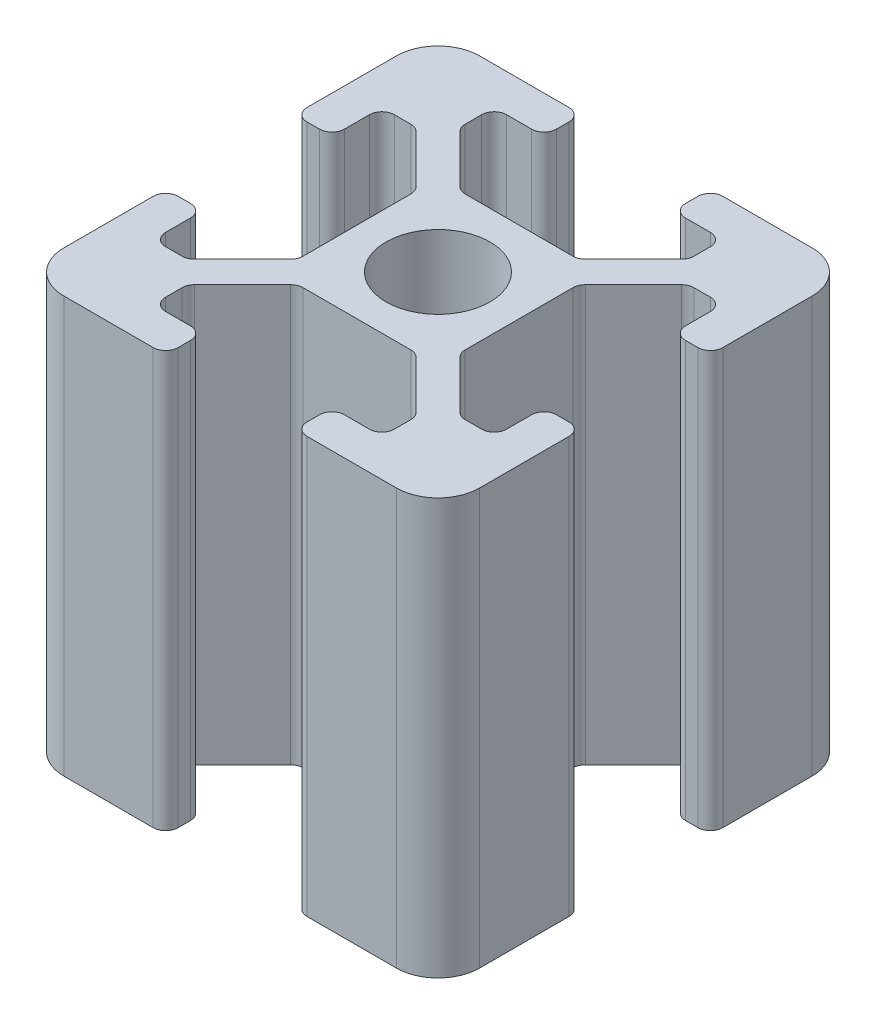
from build123d import *

# Parameters (mm, degrees)
SKETCH_1_R      = 2.5
EXTRUDE_1_DEPTH = 20


with BuildPart() as part:
    # 草图1 → 凸台-拉伸1 (new body)
    with BuildSketch(Plane(origin=(0, 0, 0), x_dir=(1, 0, 0), z_dir=(0, 1, 0))):
        with BuildLine():
            Line((3.1, 8.8), (3.1, 9.4))
            ThreePointArc((3.1, 9.4), (3.275735931, 9.824264069), (3.7, 10))
            Line((3.7, 10), (8, 10))
            ThreePointArc((8, 10), (9.414213562, 9.414213562), (10, 8))
            Line((10, 8), (10, 3.7))
            ThreePointArc((10, 3.7), (9.824264069, 3.275735931), (9.4, 3.1))
            Line((9.4, 3.1), (8.8, 3.1))
            ThreePointArc((8.8, 3.1), (8.375735931, 3.275735931), (8.2, 3.7))
            Line((8.2, 3.7), (8.2, 4.9))
            ThreePointArc((8.2, 4.9), (8.024264069, 5.324264069), (7.6, 5.5))
            Line((7.6, 5.5), (6.809188309, 5.5))
            ThreePointArc((6.809188309, 5.5), (6.57957825, 5.45432772), (6.38492424, 5.324264069))
            Line((6.38492424, 5.324264069), (4.075735931, 3.01507576))
            ThreePointArc((4.075735931, 3.01507576), (3.94567228, 2.82042175), (3.9, 2.590811691))
            Line((3.9, 2.590811691), (3.9, 0))
            Line((3.9, 0), (3.9, -2.590811691))
            ThreePointArc((3.9, -2.590811691), (3.94567228, -2.82042175), (4.075735931, -3.01507576))
            Line((4.075735931, -3.01507576), (6.38492424, -5.324264069))
            ThreePointArc((6.38492424, -5.324264069), (6.57957825, -5.45432772), (6.809188309, -5.5))
            Line((6.809188309, -5.5), (7.6, -5.5))
            ThreePointArc((7.6, -5.5), (8.024264069, -5.324264069), (8.2, -4.9))
            Line((8.2, -4.9), (8.2, -3.7))
            ThreePointArc((8.2, -3.7), (8.375735931, -3.275735931), (8.8, -3.1))
            Line((8.8, -3.1), (9.4, -3.1))
            ThreePointArc((9.4, -3.1), (9.824264069, -3.275735931), (10, -3.7))
            Line((10, -3.7), (10, -8))
            ThreePointArc((10, -8), (9.414213562, -9.414213562), (8, -10))
            Line((8, -10), (3.7, -10))
            ThreePointArc((3.7, -10), (3.275735931, -9.824264069), (3.1, -9.4))
            Line((3.1, -9.4), (3.1, -8.8))
            ThreePointArc((3.1, -8.8), (3.275735931, -8.375735931), (3.7, -8.2))
            Line((3.7, -8.2), (4.9, -8.2))
            ThreePointArc((4.9, -8.2), (5.324264069, -8.024264069), (5.5, -7.6))
            Line((5.5, -7.6), (5.5, -6.809188309))
            ThreePointArc((5.5, -6.809188309), (5.45432772, -6.57957825), (5.324264069, -6.38492424))
            Line((5.324264069, -6.38492424), (3.01507576, -4.075735931))
            ThreePointArc((3.01507576, -4.075735931), (2.82042175, -3.94567228), (2.590811691, -3.9))
            Line((2.590811691, -3.9), (0, -3.9))
            Line((0, -3.9), (-2.590811691, -3.9))
            ThreePointArc((-2.590811691, -3.9), (-2.82042175, -3.94567228), (-3.01507576, -4.075735931))
            Line((-3.01507576, -4.075735931), (-5.324264069, -6.38492424))
            ThreePointArc((-5.324264069, -6.38492424), (-5.45432772, -6.57957825), (-5.5, -6.809188309))
            Line((-5.5, -6.809188309), (-5.5, -7.6))
            ThreePointArc((-5.5, -7.6), (-5.324264069, -8.024264069), (-4.9, -8.2))
            Line((-4.9, -8.2), (-3.7, -8.2))
            ThreePointArc((-3.7, -8.2), (-3.275735931, -8.375735931), (-3.1, -8.8))
            Line((-3.1, -8.8), (-3.1, -9.4))
            ThreePointArc((-3.1, -9.4), (-3.275735931, -9.824264069), (-3.7, -10))
            Line((-3.7, -10), (-8, -10))
            ThreePointArc((-8, -10), (-9.414213562, -9.414213562), (-10, -8))
            Line((-10, -8), (-10, -3.7))
            ThreePointArc((-10, -3.7), (-9.824264069, -3.275735931), (-9.4, -3.1))
            Line((-9.4, -3.1), (-8.8, -3.1))
            ThreePointArc((-8.8, -3.1), (-8.375735931, -3.275735931), (-8.2, -3.7))
            Line((-8.2, -3.7), (-8.2, -4.9))
            ThreePointArc((-8.2, -4.9), (-8.024264069, -5.324264069), (-7.6, -5.5))
            Line((-7.6, -5.5), (-6.809188309, -5.5))
            ThreePointArc((-6.809188309, -5.5), (-6.57957825, -5.45432772), (-6.38492424, -5.324264069))
            Line((-6.38492424, -5.324264069), (-4.075735931, -3.01507576))
            ThreePointArc((-4.075735931, -3.01507576), (-3.94567228, -2.82042175), (-3.9, -2.590811691))
            Line((-3.9, -2.590811691), (-3.9, 0))
            Line((-3.9, 0), (-3.9, 2.590811691))
            ThreePointArc((-3.9, 2.590811691), (-3.94567228, 2.82042175), (-4.075735931, 3.01507576))
            Line((-4.075735931, 3.01507576), (-6.38492424, 5.324264069))
            ThreePointArc((-6.38492424, 5.324264069), (-6.57957825, 5.45432772), (-6.809188309, 5.5))
            Line((-6.809188309, 5.5), (-7.6, 5.5))
            ThreePointArc((-7.6, 5.5), (-8.024264069, 5.324264069), (-8.2, 4.9))
            Line((-8.2, 4.9), (-8.2, 3.7))
            ThreePointArc((-8.2, 3.7), (-8.375735931, 3.275735931), (-8.8, 3.1))
            Line((-8.8, 3.1), (-9.4, 3.1))
            ThreePointArc((-9.4, 3.1), (-9.824264069, 3.275735931), (-10, 3.7))
            Line((-10, 3.7), (-10, 8))
            ThreePointArc((-10, 8), (-9.414213562, 9.414213562), (-8, 10))
            Line((-8, 10), (-3.7, 10))
            ThreePointArc((-3.7, 10), (-3.275735931, 9.824264069), (-3.1, 9.4))
            Line((-3.1, 9.4), (-3.1, 8.8))
            ThreePointArc((-3.1, 8.8), (-3.275735931, 8.375735931), (-3.7, 8.2))
            Line((-3.7, 8.2), (-4.9, 8.2))
            ThreePointArc((-4.9, 8.2), (-5.324264069, 8.024264069), (-5.5, 7.6))
            Line((-5.5, 7.6), (-5.5, 6.809188309))
            ThreePointArc((-5.5, 6.809188309), (-5.45432772, 6.57957825), (-5.324264069, 6.38492424))
            Line((-5.324264069, 6.38492424), (-3.01507576, 4.075735931))
            ThreePointArc((-3.01507576, 4.075735931), (-2.82042175, 3.94567228), (-2.590811691, 3.9))
            Line((-2.590811691, 3.9), (0, 3.9))
            Line((0, 3.9), (2.590811691, 3.9))
            ThreePointArc((2.590811691, 3.9), (2.82042175, 3.94567228), (3.01507576, 4.075735931))
            Line((3.01507576, 4.075735931), (5.324264069, 6.38492424))
            ThreePointArc((5.324264069, 6.38492424), (5.45432772, 6.57957825), (5.5, 6.809188309))
            Line((5.5, 6.809188309), (5.5, 7.6))
            ThreePointArc((5.5, 7.6), (5.324264069, 8.024264069), (4.9, 8.2))
            Line((4.9, 8.2), (3.7, 8.2))
            ThreePointArc((3.7, 8.2), (3.275735931, 8.375735931), (3.1, 8.8))
        make_face()
        with Locations(Location((0, 0, 0), (0, 0, 270))):
            Circle(SKETCH_1_R, mode=Mode.SUBTRACT)
    extrude(amount=EXTRUDE_1_DEPTH)


solid = part.part
